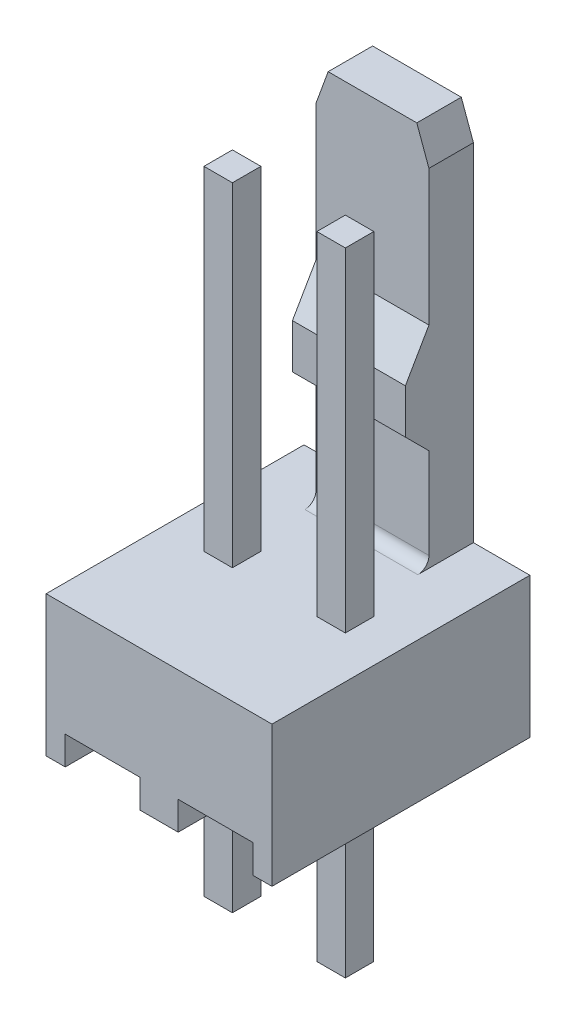
from build123d import *

# Parameters (mm, degrees)
SKETCH1_W           = 5.08
SKETCH1_H           = 5.8
BOSS_EXTRUDE1_DEPTH = 3.16
SKETCH2_W           = 2.54
SKETCH2_H           = 1
BOSS_EXTRUDE2_DEPTH = 8.54
SKETCH3_W           = 2.54
SKETCH3_H           = 6.25
BOSS_EXTRUDE3_DEPTH = 0.53
SKETCH4_W           = 1.68
SKETCH4_H           = 0.64
CUT_EXTRUDE1_DEPTH  = 12.937587696
SKETCH5_W           = 0.53
SKETCH5_H           = 3.802013072
CUT_EXTRUDE2_DEPTH  = 12.200754439
SKETCH6_W           = 1.68
SKETCH6_H           = 0.64
CUT_EXTRUDE3_DEPTH  = 12.937587696
SKETCH7_W           = 0.64
SKETCH7_H           = 0.64
BOSS_EXTRUDE4_DEPTH = 4.2
SKETCH8_W           = 0.64
SKETCH8_H           = 0.635
BOSS_EXTRUDE5_DEPTH = 4.2
SKETCH9_W           = 0.64
SKETCH9_H           = 0.64
BOSS_EXTRUDE6_DEPTH = 7.5
SKETCH10_W          = 0.64
SKETCH10_H          = 0.64
BOSS_EXTRUDE7_DEPTH = 7.5
DRAFT1_ANGLE        = 45
DRAFT2_ANGLE        = 60
CHAMFER1_SIZE       = 0.75
CHAMFER1_SIZE2      = 0.272977676
CHAMFER2_SIZE       = 0.272977676
CHAMFER2_SIZE2      = 0.75
FILLET1_R           = 0.25


with BuildPart() as part:
    # Sketch1 → Boss-Extrude1 (new body)
    with BuildSketch(Plane.XZ.offset(1.58)):
        with Locations((0, 0.02)):
            Rectangle(SKETCH1_W, SKETCH1_H)
    extrude(amount=-BOSS_EXTRUDE1_DEPTH)

    # Sketch2 → Boss-Extrude2 (add)
    with BuildSketch(Plane(origin=(0, 1.58, 0), x_dir=(-1, 0, 0), z_dir=(0, 1, 0))):
        with Locations((0, -2.38)):
            Rectangle(SKETCH2_W, SKETCH2_H)
    extrude(amount=BOSS_EXTRUDE2_DEPTH)

    # Sketch3 → Boss-Extrude3 (add)
    with BuildSketch(Plane.XY.offset(-1.88)):
        with Locations((0, 6.995)):
            Rectangle(SKETCH3_W, SKETCH3_H)
    extrude(amount=BOSS_EXTRUDE3_DEPTH)

    # Sketch4 → Cut-Extrude1 (cut, through all)
    with BuildSketch(Plane(origin=(0, 0, -2.88), x_dir=(-1, 0, 0), z_dir=(0, 0, -1))):
        with Locations((1.27, -1.26)):
            Rectangle(SKETCH4_W, SKETCH4_H)
    extrude(amount=-CUT_EXTRUDE1_DEPTH, mode=Mode.SUBTRACT)

    # Sketch5 → Cut-Extrude2 (cut, through all)
    with BuildSketch(Plane(origin=(1.27, 0, 0), x_dir=(0, 0, -1), z_dir=(1, 0, 0))):
        with Locations((1.615, 8.218993464)):
            Rectangle(SKETCH5_W, SKETCH5_H)
    extrude(amount=-CUT_EXTRUDE2_DEPTH, mode=Mode.SUBTRACT)

    # Sketch6 → Cut-Extrude3 (cut, through all)
    with BuildSketch(Plane(origin=(0, 0, -2.88), x_dir=(-1, 0, 0), z_dir=(0, 0, -1))):
        with Locations((-1.27, -1.26)):
            Rectangle(SKETCH6_W, SKETCH6_H)
    extrude(amount=-CUT_EXTRUDE3_DEPTH, mode=Mode.SUBTRACT)

    # Sketch7 → Boss-Extrude4 (add)
    with BuildSketch(Plane.XZ.offset(0.94)):
        with Locations((-1.27, 0)):
            Rectangle(SKETCH7_W, SKETCH7_H)
    extrude(amount=BOSS_EXTRUDE4_DEPTH)

    # Sketch8 → Boss-Extrude5 (add)
    with BuildSketch(Plane.XZ.offset(0.94)):
        with Locations((1.27, 0.0025)):
            Rectangle(SKETCH8_W, SKETCH8_H)
    extrude(amount=BOSS_EXTRUDE5_DEPTH)

    # Sketch9 → Boss-Extrude6 (add)
    with BuildSketch(Plane(origin=(0, 1.58, 0), x_dir=(-1, 0, 0), z_dir=(0, 1, 0))):
        with Locations((-1.27, 0)):
            Rectangle(SKETCH9_W, SKETCH9_H)
    extrude(amount=BOSS_EXTRUDE6_DEPTH)

    # Sketch10 → Boss-Extrude7 (add)
    with BuildSketch(Plane(origin=(0, 1.58, 0), x_dir=(-1, 0, 0), z_dir=(0, 1, 0))):
        with Locations((1.27, 0)):
            Rectangle(SKETCH10_W, SKETCH10_H)
    extrude(amount=BOSS_EXTRUDE7_DEPTH)

    # Draft1
    draft1_faces = [part.faces().sort_by_distance(p)[0] for p in [
        (0, 3.87, -1.615),
    ]]
    draft(draft1_faces, Plane(origin=(1.27, 10.12, -1.88), x_dir=(1, 0, 0), z_dir=(0, 0, 1)), DRAFT1_ANGLE)

    # Draft2
    draft2_faces = [part.faces().sort_by_distance(p)[0] for p in [
        (0, 6.317986928, -1.615),
    ]]
    draft(draft2_faces, Plane(origin=(-2.540025, 6.317986928, -1.88), x_dir=(1, 0, 0), z_dir=(0, 0, 1)), DRAFT2_ANGLE)

    # Chamfer1
    chamfer1_edges = [part.edges().sort_by_distance(p)[0] for p in [
        (1.27, 10.12, -2.38),
    ]]
    chamfer1_side = [part.faces().sort_by_distance(p)[0] for p in [
        (1.27, 5.768868228, -2.309646908),
    ]]
    chamfer(chamfer1_edges, length=CHAMFER1_SIZE, length2=CHAMFER1_SIZE2, reference=chamfer1_side[0])

    # Chamfer2
    chamfer2_edges = [part.edges().sort_by_distance(p)[0] for p in [
        (-1.27, 10.12, -2.38),
    ]]
    chamfer2_side = [part.faces().sort_by_distance(p)[0] for p in [
        (-0.136488838, 10.12, -2.38),
    ]]
    chamfer(chamfer2_edges, length=CHAMFER2_SIZE, length2=CHAMFER2_SIZE2, reference=chamfer2_side[0])

    # Fillet1
    fillet1_edges = [part.edges().sort_by_distance(p)[0] for p in [
        (0, 1.58, -1.88),
    ]]
    fillet(fillet1_edges, radius=FILLET1_R)


solid = part.part
